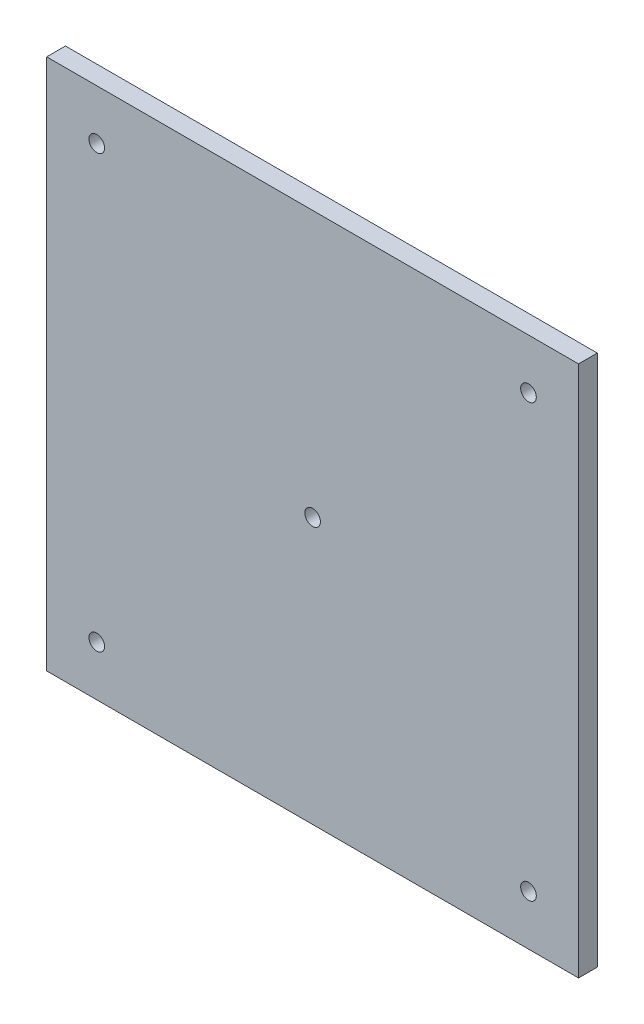
from build123d import *

# Parameters (mm, degrees)
ESQUISSE1_W             = 85
ESQUISSE1_H             = 85
BOSS_EXTRU_1_DEPTH      = 3
ESQUISSE2_R             = 1.25
ENL_V_MAT_EXTRU_1_DEPTH = 3
ESQUISSE3_R             = 1.25
ENL_V_MAT_EXTRU_2_DEPTH = 10


with BuildPart() as part:
    # Esquisse1 → Boss.-Extru.1 (new body)
    with BuildSketch(Plane.XY):
        with Locations((9.887537717, -23.300013855)):
            Rectangle(ESQUISSE1_W, ESQUISSE1_H)
    extrude(amount=BOSS_EXTRU_1_DEPTH)

    # Esquisse2 → Enlèv. mat.-Extru.1 (cut)
    with BuildSketch(Plane.XY.offset(3)):
        with Locations((-24.612462283, 11.199986145)):
            Circle(ESQUISSE2_R)
        with Locations((44.387537717, 11.199986145)):
            Circle(ESQUISSE2_R)
        with Locations((-24.612462283, -57.800013855)):
            Circle(ESQUISSE2_R)
        with Locations((44.387537717, -57.800013855)):
            Circle(ESQUISSE2_R)
    extrude(amount=-ENL_V_MAT_EXTRU_1_DEPTH, mode=Mode.SUBTRACT)

    # Esquisse3 → Enlèv. mat.-Extru.2 (cut)
    with BuildSketch(Plane.XY.offset(3)):
        with Locations((9.887537717, -23.300013855)):
            Circle(ESQUISSE3_R)
    extrude(amount=-ENL_V_MAT_EXTRU_2_DEPTH, mode=Mode.SUBTRACT)


solid = part.part
